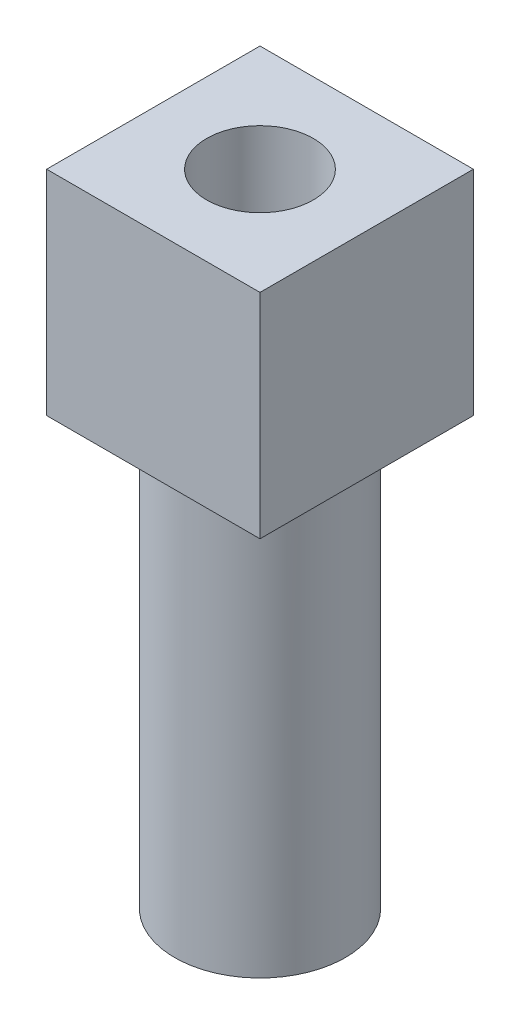
from build123d import *

# Parameters (mm, degrees)
SKIZZE1_W                       = 4
SKIZZE1_H                       = 20
SKIZZE5_W                       = 10
SKIZZE5_H                       = 10
AUFSATZ_LINEAR_AUSTRAGEN1_DEPTH = 10
SKETCH1_R                       = 2.5
CUT_EXTRUDE1_DEPTH              = 31.822070015


with BuildPart() as part:
    # Skizze1 → Rotation1 (revolve)
    with BuildSketch(Plane.XY, mode=Mode.PRIVATE) as rotation1_sk:
        with Locations((2, 10)):
            Rectangle(SKIZZE1_W, SKIZZE1_H)
    revolve(rotation1_sk.sketch.rotate(Axis((0, -2.459302686, 0), (0, 1, 0)), 90), axis=Axis((0, -2.459302686, 0), (0, 1, 0)))

    # Skizze5 → Aufsatz-Linear austragen1 (add)
    with BuildSketch(Plane(origin=(0, 20, 0), x_dir=(1, 0, 0), z_dir=(0, 1, 0))):
        Rectangle(SKIZZE5_W, SKIZZE5_H)
    extrude(amount=AUFSATZ_LINEAR_AUSTRAGEN1_DEPTH)

    # Sketch1 → Cut-Extrude1 (cut, through all)
    with BuildSketch(Plane(origin=(0, 30, 0), x_dir=(1, 0, 0), z_dir=(0, 1, 0))):
        with Locations(Location((0, 0, 0), (0, 0, 270))):
            Circle(SKETCH1_R)
    extrude(amount=-CUT_EXTRUDE1_DEPTH, mode=Mode.SUBTRACT)


solid = part.part
